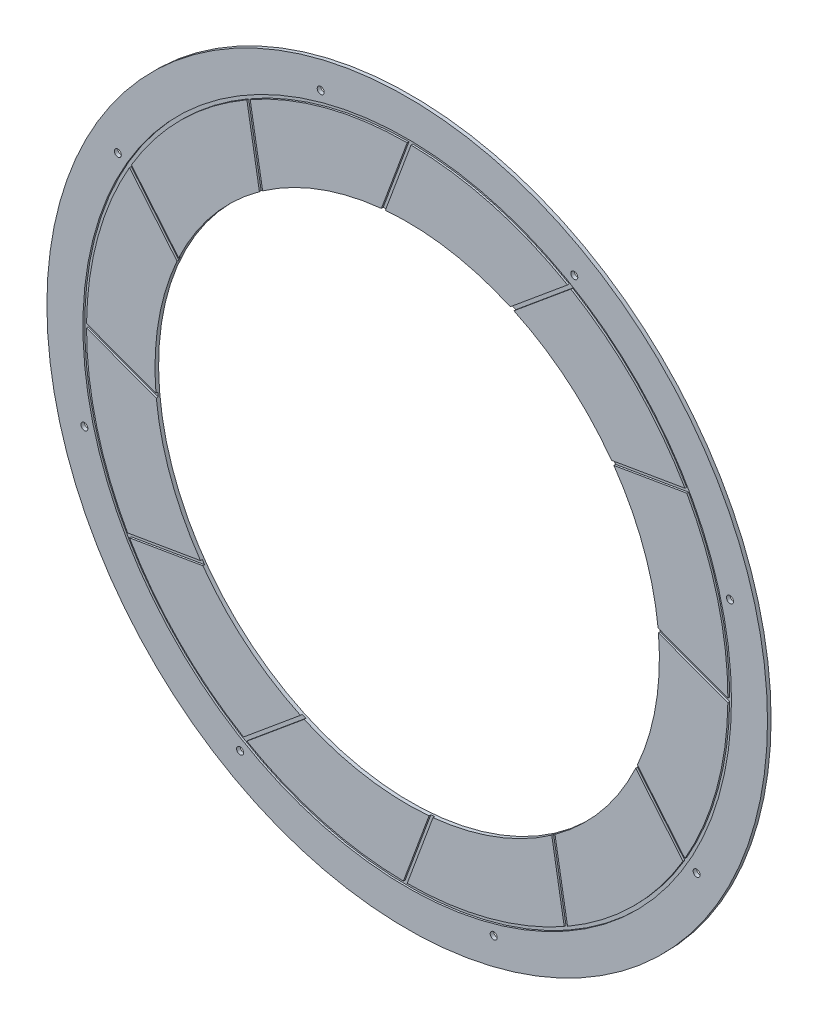
from build123d import *

# Parameters (mm, degrees)
SKETCH1_R                    = 254
SKETCH1_R_2                  = 177.8
BOSS_EXTRUDE1_DEPTH          = 2.54
SKETCH2_R                    = 228.6
SKETCH2_R_2                  = 226.06
CUT_EXTRUDE1_DEPTH           = 1.27
CUT_EXTRUDE2_DEPTH           = 1.27
F_10_0_1935_DIAMETER_HOLE2_D = 4.9149


with BuildPart() as part:
    # Sketch1 → Boss-Extrude1 (new body)
    with BuildSketch(Plane.XY):
        Circle(SKETCH1_R)
        Circle(SKETCH1_R_2, mode=Mode.SUBTRACT)
    extrude(amount=BOSS_EXTRUDE1_DEPTH)

    # Sketch2 → Cut-Extrude1 (cut)
    with BuildSketch(Plane.XY.offset(2.54)):
        Circle(SKETCH2_R)
        Circle(SKETCH2_R_2, mode=Mode.SUBTRACT)
    extrude(amount=-CUT_EXTRUDE1_DEPTH, mode=Mode.SUBTRACT)

    # Sketch4 → Cut-Extrude2 (cut)
    with BuildSketch(Plane.XY.offset(2.54)):
        with BuildLine():
            Line((-226.06, 0), (-176.125415463, -18.479751401))
            Line((-176.125415463, -18.479751401), (-175.243846947, -16.097643731))
            Line((-175.243846947, -16.097643731), (-226.043846947, 2.702379938))
            ThreePointArc((-226.043846947, 2.702379938), (-226.055961701, 1.351214107), (-226.06, 0))
        make_face()
        with BuildLine():
            Line((-195.77370278, 113.03), (-161.768959743, 72.058773562))
            Line((-161.768959743, 72.058773562), (-159.814445179, 73.680955061))
            Line((-159.814445179, 73.680955061), (-194.408523857, 115.36225315))
            ThreePointArc((-194.408523857, 115.36225315), (-195.094598456, 114.198166593), (-195.77370278, 113.03))
        make_face()
        with BuildLine():
            Line((-113.03, 195.77370278), (-104.066641901, 143.289208342))
            Line((-104.066641901, 143.289208342), (-101.562891886, 143.716801448))
            Line((-101.562891886, 143.716801448), (-110.681593797, 197.110903794))
            ThreePointArc((-110.681593797, 197.110903794), (-111.857795108, 196.445812563), (-113.03, 195.77370278))
        make_face()
        with BuildLine():
            Line((0, 226.06), (-18.479751401, 176.125415463))
            Line((-18.479751401, 176.125415463), (-16.097643731, 175.243846947))
            Line((-16.097643731, 175.243846947), (2.702379938, 226.043846947))
            ThreePointArc((2.702379938, 226.043846947), (1.351214107, 226.055961701), (0, 226.06))
        make_face()
        with BuildLine():
            Line((113.03, 195.77370278), (72.058773562, 161.768959743))
            Line((72.058773562, 161.768959743), (73.680955061, 159.814445179))
            Line((73.680955061, 159.814445179), (115.36225315, 194.408523857))
            ThreePointArc((115.36225315, 194.408523857), (114.198166593, 195.094598456), (113.03, 195.77370278))
        make_face()
        with BuildLine():
            Line((195.77370278, 113.03), (143.289208342, 104.066641901))
            Line((143.289208342, 104.066641901), (143.716801448, 101.562891886))
            Line((143.716801448, 101.562891886), (197.110903794, 110.681593797))
            ThreePointArc((197.110903794, 110.681593797), (196.445812563, 111.857795108), (195.77370278, 113.03))
        make_face()
        with BuildLine():
            Line((226.06, 0), (176.125415463, 18.479751401))
            Line((176.125415463, 18.479751401), (175.243846947, 16.097643731))
            Line((175.243846947, 16.097643731), (226.043846947, -2.702379938))
            ThreePointArc((226.043846947, -2.702379938), (226.055961701, -1.351214107), (226.06, 0))
        make_face()
        with BuildLine():
            Line((195.77370278, -113.03), (161.768959743, -72.058773562))
            Line((161.768959743, -72.058773562), (159.814445179, -73.680955061))
            Line((159.814445179, -73.680955061), (194.408523857, -115.36225315))
            ThreePointArc((194.408523857, -115.36225315), (195.094598456, -114.198166593), (195.77370278, -113.03))
        make_face()
        with BuildLine():
            Line((113.03, -195.77370278), (104.066641901, -143.289208342))
            Line((104.066641901, -143.289208342), (101.562891886, -143.716801448))
            Line((101.562891886, -143.716801448), (110.681593797, -197.110903794))
            ThreePointArc((110.681593797, -197.110903794), (111.857795108, -196.445812563), (113.03, -195.77370278))
        make_face()
        with BuildLine():
            Line((0, -226.06), (18.479751401, -176.125415463))
            Line((18.479751401, -176.125415463), (16.097643731, -175.243846947))
            Line((16.097643731, -175.243846947), (-2.702379938, -226.043846947))
            ThreePointArc((-2.702379938, -226.043846947), (-1.351214107, -226.055961701), (0, -226.06))
        make_face()
        with BuildLine():
            Line((-113.03, -195.77370278), (-72.058773562, -161.768959743))
            Line((-72.058773562, -161.768959743), (-73.680955061, -159.814445179))
            Line((-73.680955061, -159.814445179), (-115.36225315, -194.408523857))
            ThreePointArc((-115.36225315, -194.408523857), (-114.198166593, -195.094598456), (-113.03, -195.77370278))
        make_face()
        with BuildLine():
            Line((-195.77370278, -113.03), (-143.289208342, -104.066641901))
            Line((-143.289208342, -104.066641901), (-143.716801448, -101.562891886))
            Line((-143.716801448, -101.562891886), (-197.110903794, -110.681593797))
            ThreePointArc((-197.110903794, -110.681593797), (-196.445812563, -111.857795108), (-195.77370278, -113.03))
        make_face()
    extrude(amount=-CUT_EXTRUDE2_DEPTH, mode=Mode.SUBTRACT)

    # #10 (0.1935) Diameter Hole2 (through all)
    with Locations(Plane.XY.offset(2.54)):
        with Locations((-204.022594751, 117.7925), (-60.97388474, 227.557635786), (117.7925, 204.022594751), (227.557635786, 60.97388474), (204.022594751, -117.7925), (60.97388474, -227.557635786), (-117.7925, -204.022594751), (-227.557635786, -60.97388474)):
            Hole(F_10_0_1935_DIAMETER_HOLE2_D / 2)


solid = part.part
